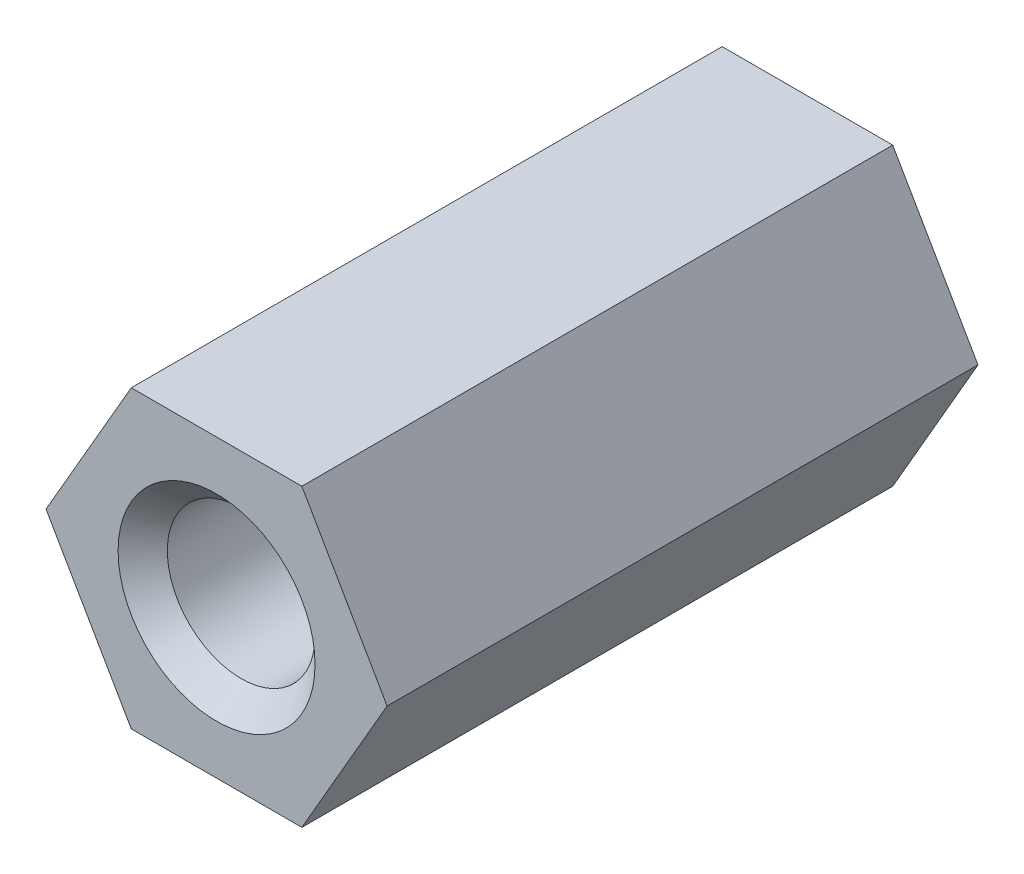
from build123d import *

# Parameters (mm, degrees)
SKETCH1_R           = 1.5
BOSS_EXTRUDE1_DEPTH = 6
CHAMFER1_SIZE       = 0.5


with BuildPart() as part:
    # Sketch1 → Boss-Extrude1 (new, symmetric)
    with BuildSketch(Plane.XY):
        Polygon((3.464101615, 0), (1.732050808, 3), (-1.732050808, 3), (-3.464101615, 0), (-1.732050808, -3), (1.732050808, -3), align=None)
        Circle(SKETCH1_R, mode=Mode.SUBTRACT)
    extrude(amount=BOSS_EXTRUDE1_DEPTH, both=True)

    # Chamfer1
    chamfer1_edges = [part.edges().sort_by_distance(p)[0] for p in [
        (-1.5, 0, 6),
    ]]
    chamfer(chamfer1_edges, length=CHAMFER1_SIZE)


solid = part.part
